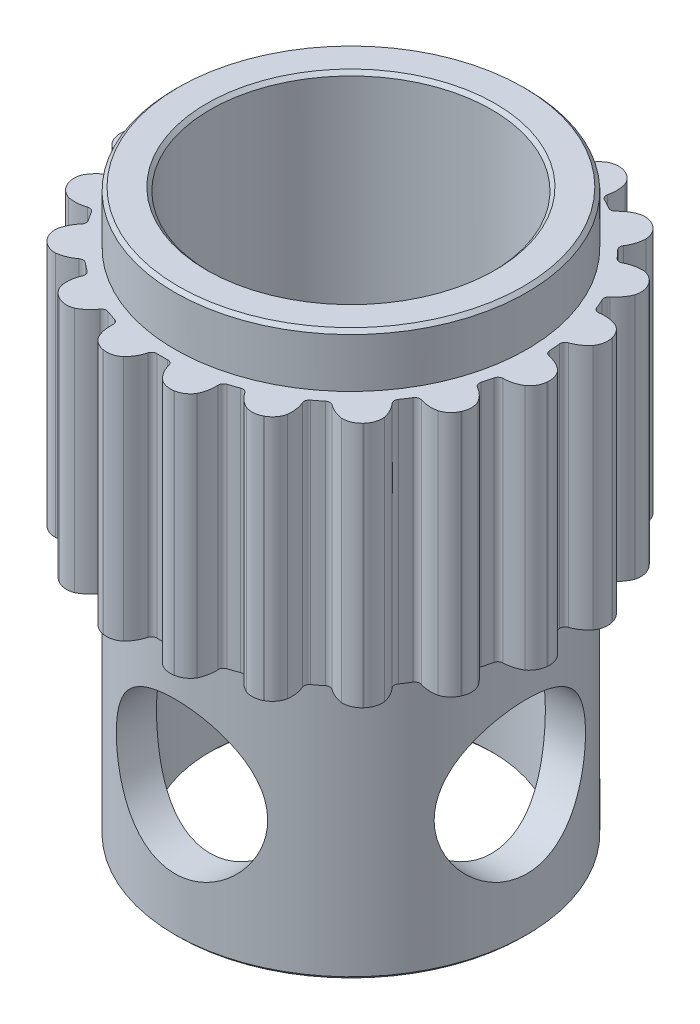
from build123d import *

# Parameters (mm, degrees)
BODYS_W                = 2.11
BODYS_H                = 7
GT2PROFILE_DEPTH       = 3.5
GT2_GROOVE_CP_COUNT    = 19
TOPWALLS_R             = 5
TOPWALLS_R_2           = 4
TOPWALL_DEPTH          = 1.5
BOTTOMWALL_START       = 7.5
BOTTOMWALLS_R          = 5
BOTTOMWALLS_R_2        = 4
BOTTOMWALL_DEPTH       = 7.5
CLEARANCE_HOLE1_REACH  = 18.779
CLEARANCE_HOLE1_BORE_R = 2.15
CIRPATTERN1_COUNT      = 2
CIRPATTERN1_ANGLE      = 90
INNERC_SIZE            = 0.1
OUTERC_SIZE            = 0.1


with BuildPart() as part:
    # BodyS → Body (revolve)
    with BuildSketch(Plane.XY, mode=Mode.PRIVATE) as body_sk:
        with Locations((5.055, 0)):
            Rectangle(BODYS_W, BODYS_H)
    revolve(body_sk.sketch.rotate(Axis((0, 3.5, 0), (0, -1, 0)), 90), axis=Axis((0, 3.5, 0), (0, -1, 0)))

    # GT2ProfileS → GT2Profile (cut, symmetric)
    with BuildSketch(Plane(origin=(0, 0, 0), x_dir=(1, 0, 0), z_dir=(0, 1, 0))):
        with BuildLine():
            ThreePointArc((0.299749921, -5.468781955), (0.244461347, -5.387479579), (0.150701934, -5.357881011))
            ThreePointArc((0.150701934, -5.357881011), (0, -5.36), (-0.150701934, -5.357881011))
            ThreePointArc((-0.150701934, -5.357881011), (-0.244461347, -5.387479579), (-0.299749921, -5.468781955))
            ThreePointArc((-0.299749921, -5.468781955), (-0.396626607, -5.703924717), (-0.549685833, -5.907025885))
            ThreePointArc((-0.549685833, -5.907025885), (-0.7593874, -6.016293358), (-0.995541542, -6.028349446))
            ThreePointArc((-0.995541542, -6.028349446), (0, -6.11), (0.995541542, -6.028349446))
            ThreePointArc((0.995541542, -6.028349446), (0.7593874, -6.016293358), (0.549685833, -5.907025885))
            ThreePointArc((0.549685833, -5.907025885), (0.396626607, -5.703924717), (0.299749921, -5.468781955))
        make_face()
    gt2profile = extrude(amount=GT2PROFILE_DEPTH, both=True, mode=Mode.SUBTRACT)

    # GT2 Groove CP: GT2Profile ×19 about axis
    gt2_groove_cp_axis = Axis((0, 0, 0), (0, 1, 0))
    for i in range(1, GT2_GROOVE_CP_COUNT):
        add(gt2profile.rotate(gt2_groove_cp_axis, i * 360 / GT2_GROOVE_CP_COUNT), mode=Mode.SUBTRACT)

    # TopWallS → TopWall (add)
    with BuildSketch(Plane(origin=(0, 3.5, 0), x_dir=(1, 0, 0), z_dir=(0, 1, 0))):
        with Locations(Location((0, 0, 0), (0, 0, 90))):
            Circle(TOPWALLS_R)
        with Locations(Location((0, 0, 0), (0, 0, 270))):
            Circle(TOPWALLS_R_2, mode=Mode.SUBTRACT)
    extrude(amount=TOPWALL_DEPTH)

    # BottomWallS → BottomWall (add)
    with BuildSketch(Plane(origin=(0, -3.5, 0), x_dir=(-1, 0, 0), z_dir=(0, -1, 0)).offset(BOTTOMWALL_START)):
        with Locations(Location((0, 0, 0), (0, 0, 90))):
            Circle(BOTTOMWALLS_R)
        with Locations(Location((0, 0, 0), (0, 0, 270))):
            Circle(BOTTOMWALLS_R_2, mode=Mode.SUBTRACT)
    extrude(amount=-BOTTOMWALL_DEPTH)

    # Clearance Hole1 bore → Clearance Hole1 (cut, up to next)
    with BuildSketch(Plane.XY.offset(5), mode=Mode.PRIVATE) as clearance_hole1_sk1:
        with Locations((0, -7.25)):
            Circle(CLEARANCE_HOLE1_BORE_R)
    clearance_hole1_tool1 = extrude(clearance_hole1_sk1.sketch, amount=-CLEARANCE_HOLE1_REACH, mode=Mode.PRIVATE) & part.part
    clearance_hole1 = clearance_hole1_tool1.solids().sort_by_distance((0, -7.25, 5))[0]
    add(clearance_hole1, mode=Mode.SUBTRACT)

    # CirPattern1: Clearance Hole1 ×2 about axis
    cirpattern1_axis = Axis((0, -11, 0), (0, 1, 0))
    for i in range(1, CIRPATTERN1_COUNT):
        add(clearance_hole1.rotate(cirpattern1_axis, i * CIRPATTERN1_ANGLE / (CIRPATTERN1_COUNT - 1)), mode=Mode.SUBTRACT)

    # InnerC
    innerc_edges = [part.edges().sort_by_distance(p)[0] for p in [
        (0, 5, -4),
        (0, -11, -4),
    ]]
    chamfer(innerc_edges, length=INNERC_SIZE)

    # OuterC
    outerc_edges = [part.edges().sort_by_distance(p)[0] for p in [
        (0, 5, 5),
        (0, -11, 5),
    ]]
    chamfer(outerc_edges, length=OUTERC_SIZE)


solid = part.part
